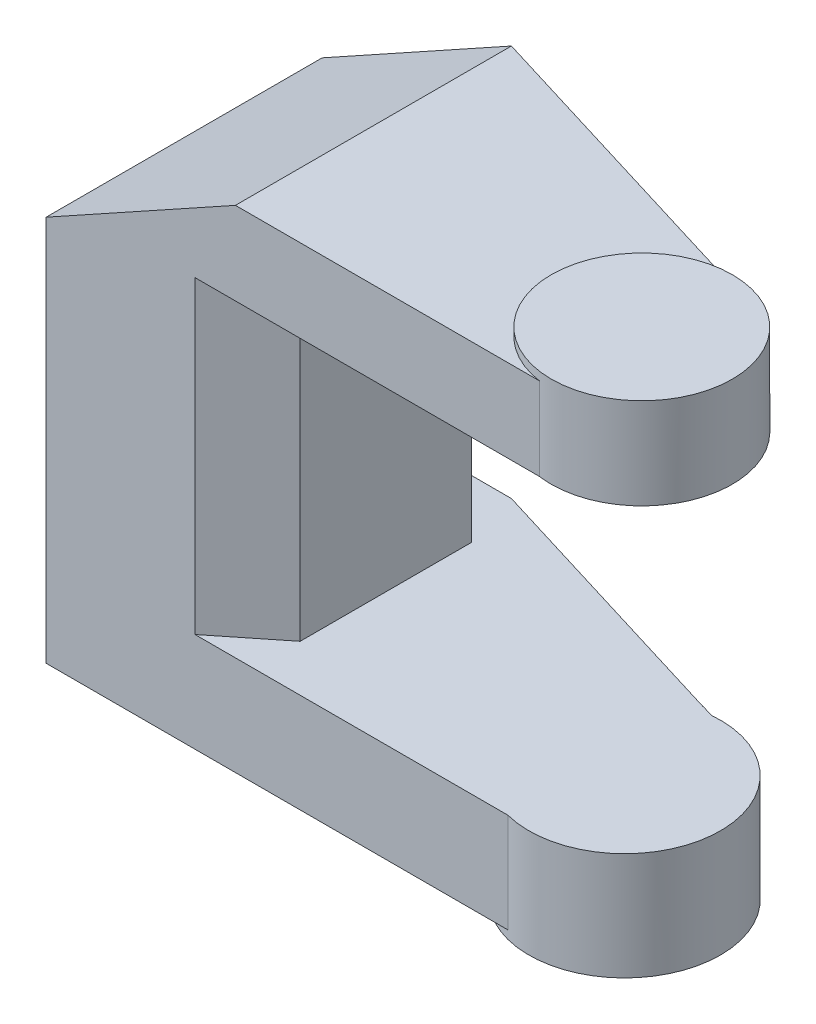
from build123d import *

# Parameters (mm, degrees)
BOSS_EXTRUDE1_DEPTH = 250
SKETCH3_W           = 80
SKETCH3_H           = 90
BOSS_EXTRUDE3_DEPTH = 250
CUT_EXTRUDE1_DEPTH  = 500
CUT_EXTRUDE2_DEPTH  = 500
BOSS_EXTRUDE4_DEPTH = 75
SKETCH7_R           = 82
BOSS_EXTRUDE5_DEPTH = 75
SKETCH8_R           = 86.820358575
BOSS_EXTRUDE6_DEPTH = 90
BOSS_EXTRUDE7_START = 7.5
SKETCH9_R           = 82
BOSS_EXTRUDE7_DEPTH = 7.5
SKETCH10_R          = 86.820358575
BOSS_EXTRUDE8_DEPTH = 7.5
BOSS_EXTRUDE9_DEPTH = 280


with BuildPart() as part:
    # Sketch2 → Boss-Extrude1 (new body)
    with BuildSketch(Plane.XY):
        Polygon((0, 0), (0, 350), (171.438035453, 445), (421.438035453, 445), (421.438035453, 370), (134.808708212, 370), (134.808708212, 90), (360, 90), (360, 0), align=None)
    extrude(amount=-BOSS_EXTRUDE1_DEPTH)

    # Sketch3 → Boss-Extrude3 (add)
    with BuildSketch(Plane.XY):
        with Locations((400, 45)):
            Rectangle(SKETCH3_W, SKETCH3_H)
    extrude(amount=-BOSS_EXTRUDE3_DEPTH)

    # Sketch4 → Cut-Extrude1 (cut)
    with BuildSketch(Plane(origin=(0, 445, 0), x_dir=(1, 0, 0), z_dir=(0, 1, 0))):
        Polygon((171.438035453, 250), (421.438035453, 173.567329635), (421.438035453, 250), align=None)
    extrude(amount=-CUT_EXTRUDE1_DEPTH, mode=Mode.SUBTRACT)

    # Sketch5 → Cut-Extrude2 (cut)
    with BuildSketch(Plane(origin=(0, 90, 0), x_dir=(1, 0, 0), z_dir=(0, 1, 0))):
        Polygon((171.438035453, 250), (529.292603831, 140.837226457), (529.292603831, 329.490615835), align=None)
    extrude(amount=-CUT_EXTRUDE2_DEPTH, mode=Mode.SUBTRACT)

    # Sketch6 → Boss-Extrude4 (add)
    with BuildSketch(Plane(origin=(0, 445, 0), x_dir=(1, 0, 0), z_dir=(0, 1, 0))):
        Polygon((458.366845574, 162.410857278), (421.438035453, 173.567329635), (419.282590182, 0), (458.366845574, 0), align=None)
    extrude(amount=-BOSS_EXTRUDE4_DEPTH)

    # Sketch7 → Boss-Extrude5 (add)
    with BuildSketch(Plane(origin=(0, 445, 0), x_dir=(1, 0, 0), z_dir=(0, 1, 0))):
        with Locations((458.366845574, 81.205428639)):
            Circle(SKETCH7_R)
    extrude(amount=-BOSS_EXTRUDE5_DEPTH)

    # Sketch8 → Boss-Extrude6 (add)
    with BuildSketch(Plane(origin=(0, 90, 0), x_dir=(1, 0, 0), z_dir=(0, 1, 0))):
        with Locations((440, 84.037872492)):
            Circle(SKETCH8_R)
    extrude(amount=-BOSS_EXTRUDE6_DEPTH)

    # Sketch9 → Boss-Extrude7 (add)
    with BuildSketch(Plane(origin=(0, 445, 0), x_dir=(1, 0, 0), z_dir=(0, 1, 0)).offset(BOSS_EXTRUDE7_START)):
        with Locations(Location((458.366845574, 81.205428639, 0), (0, 0, 270))):
            Circle(SKETCH9_R)
    extrude(amount=-BOSS_EXTRUDE7_DEPTH)

    # Sketch10 → Boss-Extrude8 (add)
    with BuildSketch(Plane.XZ):
        with Locations(Location((440, -84.037872492, 0), (0, 0, 104.544878668))):
            Circle(SKETCH10_R)
    extrude(amount=BOSS_EXTRUDE8_DEPTH)

    # Sketch11 → Boss-Extrude9 (add)
    with BuildSketch(Plane(origin=(0, 90, 0), x_dir=(1, 0, 0), z_dir=(0, 1, 0))):
        Polygon((134.808708212, 0), (187.780197763, 42.295296089), (187.780197763, 197.600080779), (134.808708212, 250), align=None)
    extrude(amount=BOSS_EXTRUDE9_DEPTH)


solid = part.part
